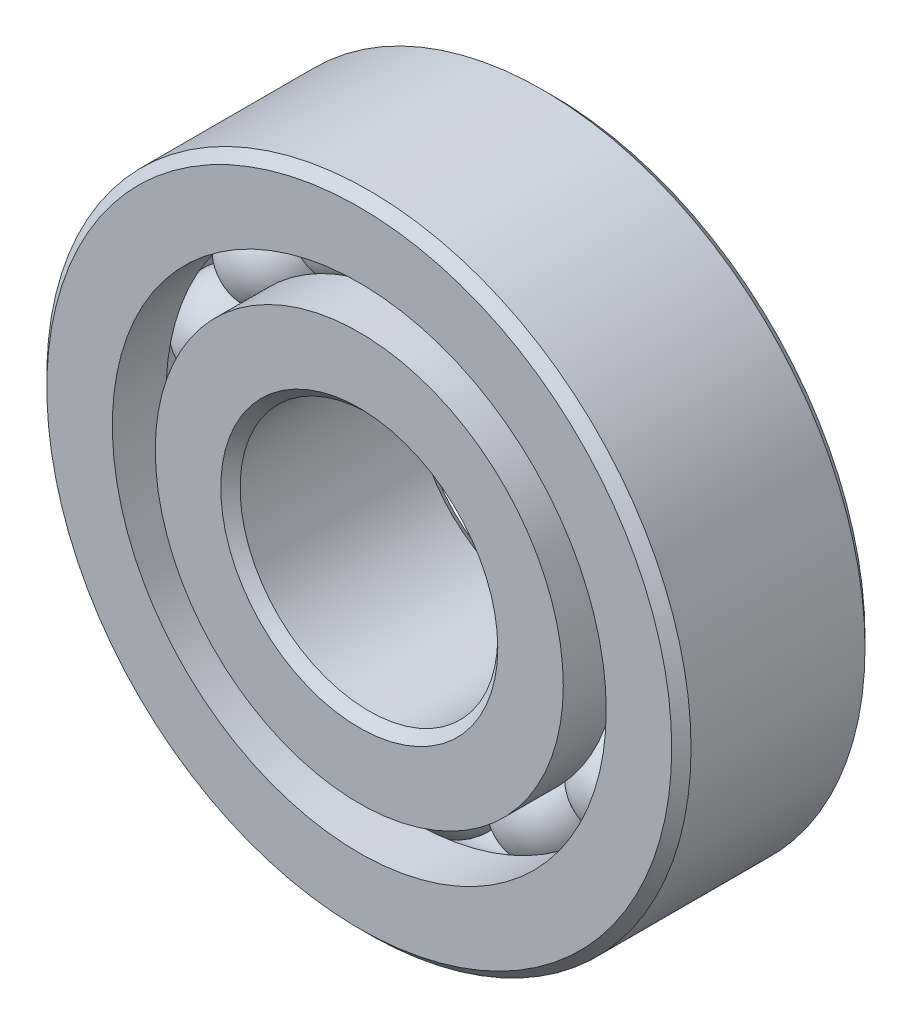
from build123d import *

# Parameters (mm, degrees)
CIRPATTERN1_COUNT = 14


with BuildPart() as part:
    # Sketch1 → Revolve1 (revolve)
    with BuildSketch(Plane(origin=(0, 0, 0), x_dir=(0, 0, -1), z_dir=(1, 0, 0))):
        with BuildLine():
            Line((0.675, 2.5), (-0.675, 2.5))
            Line((-0.675, 2.5), (-0.75, 2.425))
            Line((-0.75, 2.425), (-0.75, 1.916666667))
            Line((-0.75, 1.916666667), (-0.333333333, 1.916666667))
            ThreePointArc((-0.333333333, 1.916666667), (0, 2.122677996), (0.333333333, 1.916666667))
            Line((0.333333333, 1.916666667), (0.75, 1.916666667))
            Line((0.75, 1.916666667), (0.75, 2.425))
            Line((0.75, 2.425), (0.675, 2.5))
        make_face()
    revolve(axis=Axis((0, 0, 0.75), (0, 0, -1)))


with BuildPart() as body_2:
    # Sketch2 → Revolve2 (revolve)
    with BuildSketch(Plane(origin=(0, 0, 0), x_dir=(0, 0, -1), z_dir=(1, 0, 0))):
        with BuildLine():
            Line((-0.75, 1.583333333), (-0.333333333, 1.583333333))
            ThreePointArc((-0.333333333, 1.583333333), (0, 1.377322004), (0.333333333, 1.583333333))
            Line((0.333333333, 1.583333333), (0.75, 1.583333333))
            Line((0.75, 1.583333333), (0.75, 1.075))
            Line((0.75, 1.075), (0.675, 1))
            Line((0.675, 1), (-0.675, 1))
            Line((-0.675, 1), (-0.75, 1.075))
            Line((-0.75, 1.075), (-0.75, 1.583333333))
        make_face()
    revolve(axis=Axis((0, 0, 0.75), (0, 0, -1)))


with BuildPart() as body_3:
    # Sketch3 → Revolve3 (revolve)
    with BuildSketch(Plane(origin=(0, 0, 0), x_dir=(0, 0, -1), z_dir=(1, 0, 0))):
        with BuildLine():
            Line((-0.372677996, 1.75), (0.372677996, 1.75))
            ThreePointArc((0.372677996, 1.75), (0, 2.122677996), (-0.372677996, 1.75))
        make_face()
    revolve(axis=Axis((0, 1.75, 0.372677996), (0, 0, -1)))


with BuildPart() as cirpattern1_1:
    # CirPattern1: pattern copy
    add(body_3.part.rotate(Axis((0, 0, -0.75), (0, 0, 1)), 1 * 360 / CIRPATTERN1_COUNT))


with BuildPart() as cirpattern1_2:
    # CirPattern1: pattern copy
    add(body_3.part.rotate(Axis((0, 0, -0.75), (0, 0, 1)), 2 * 360 / CIRPATTERN1_COUNT))


with BuildPart() as cirpattern1_3:
    # CirPattern1: pattern copy
    add(body_3.part.rotate(Axis((0, 0, -0.75), (0, 0, 1)), 3 * 360 / CIRPATTERN1_COUNT))


with BuildPart() as cirpattern1_4:
    # CirPattern1: pattern copy
    add(body_3.part.rotate(Axis((0, 0, -0.75), (0, 0, 1)), 4 * 360 / CIRPATTERN1_COUNT))


with BuildPart() as cirpattern1_5:
    # CirPattern1: pattern copy
    add(body_3.part.rotate(Axis((0, 0, -0.75), (0, 0, 1)), 5 * 360 / CIRPATTERN1_COUNT))


with BuildPart() as cirpattern1_6:
    # CirPattern1: pattern copy
    add(body_3.part.rotate(Axis((0, 0, -0.75), (0, 0, 1)), 6 * 360 / CIRPATTERN1_COUNT))


with BuildPart() as cirpattern1_7:
    # CirPattern1: pattern copy
    add(body_3.part.rotate(Axis((0, 0, -0.75), (0, 0, 1)), 7 * 360 / CIRPATTERN1_COUNT))


with BuildPart() as cirpattern1_8:
    # CirPattern1: pattern copy
    add(body_3.part.rotate(Axis((0, 0, -0.75), (0, 0, 1)), 8 * 360 / CIRPATTERN1_COUNT))


with BuildPart() as cirpattern1_9:
    # CirPattern1: pattern copy
    add(body_3.part.rotate(Axis((0, 0, -0.75), (0, 0, 1)), 9 * 360 / CIRPATTERN1_COUNT))


with BuildPart() as cirpattern1_10:
    # CirPattern1: pattern copy
    add(body_3.part.rotate(Axis((0, 0, -0.75), (0, 0, 1)), 10 * 360 / CIRPATTERN1_COUNT))


with BuildPart() as cirpattern1_11:
    # CirPattern1: pattern copy
    add(body_3.part.rotate(Axis((0, 0, -0.75), (0, 0, 1)), 11 * 360 / CIRPATTERN1_COUNT))


with BuildPart() as cirpattern1_12:
    # CirPattern1: pattern copy
    add(body_3.part.rotate(Axis((0, 0, -0.75), (0, 0, 1)), 12 * 360 / CIRPATTERN1_COUNT))


with BuildPart() as cirpattern1_13:
    # CirPattern1: pattern copy
    add(body_3.part.rotate(Axis((0, 0, -0.75), (0, 0, 1)), 13 * 360 / CIRPATTERN1_COUNT))


solid = Compound([part.part, body_2.part, body_3.part, cirpattern1_1.part, cirpattern1_2.part, cirpattern1_3.part, cirpattern1_4.part, cirpattern1_5.part, cirpattern1_6.part, cirpattern1_7.part, cirpattern1_8.part, cirpattern1_9.part, cirpattern1_10.part, cirpattern1_11.part, cirpattern1_12.part, cirpattern1_13.part])
